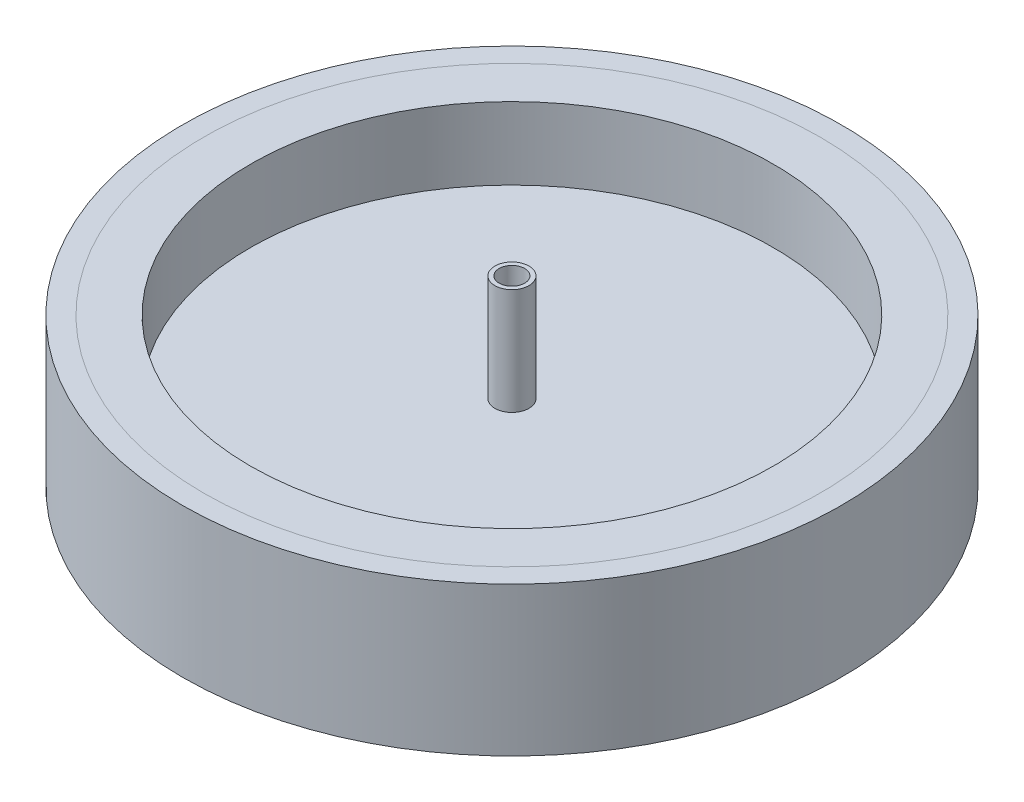
from build123d import *

# Parameters (mm, degrees)
SKETCH1_R           = 72.5
BOSS_EXTRUDE1_DEPTH = 35
SKETCH2_R           = 61.5
CUT_EXTRUDE2_DEPTH  = 17
SKETCH4_R           = 4
BOSS_EXTRUDE2_DEPTH = 25
SKETCH5_R           = 3
CUT_EXTRUDE4_DEPTH  = 9
SKETCH8_W           = 5
SKETCH8_H           = 35


with BuildPart() as part:
    # Sketch1 → Boss-Extrude1 (new body)
    with BuildSketch(Plane(origin=(0, 0, 0), x_dir=(1, 0, 0), z_dir=(0, 1, 0))):
        with Locations(Location((0, 0, 0), (0, 0, 270))):
            Circle(SKETCH1_R)
    extrude(amount=BOSS_EXTRUDE1_DEPTH)

    # Sketch2 → Cut-Extrude2 (cut)
    with BuildSketch(Plane(origin=(0, 35, 0), x_dir=(1, 0, 0), z_dir=(0, 1, 0))):
        with Locations(Location((0, 0, 0), (0, 0, 270))):
            Circle(SKETCH2_R)
    extrude(amount=-CUT_EXTRUDE2_DEPTH, mode=Mode.SUBTRACT)

    # Sketch4 → Boss-Extrude2 (add)
    with BuildSketch(Plane(origin=(0, 18, 0), x_dir=(1, 0, 0), z_dir=(0, 1, 0))):
        with Locations(Location((0, 0, 0), (0, 0, 270))):
            Circle(SKETCH4_R)
    extrude(amount=BOSS_EXTRUDE2_DEPTH)

    # Sketch5 → Cut-Extrude4 (cut)
    with BuildSketch(Plane(origin=(0, 43, 0), x_dir=(1, 0, 0), z_dir=(0, 1, 0))):
        with Locations(Location((0, 0, 0), (0, 0, 270))):
            Circle(SKETCH5_R)
    extrude(amount=-CUT_EXTRUDE4_DEPTH, mode=Mode.SUBTRACT)


with BuildPart() as body_2:
    # Sketch8 → Revolve1 (revolve)
    with BuildSketch(Plane.XY, mode=Mode.PRIVATE) as revolve1_sk:
        with Locations((-75, 17.5)):
            Rectangle(SKETCH8_W, SKETCH8_H)
    revolve(revolve1_sk.sketch.rotate(Axis((0, 40.543459587, 0), (0, -1, 0)), 270), axis=Axis((0, 40.543459587, 0), (0, -1, 0)))


solid = Compound([part.part, body_2.part])
